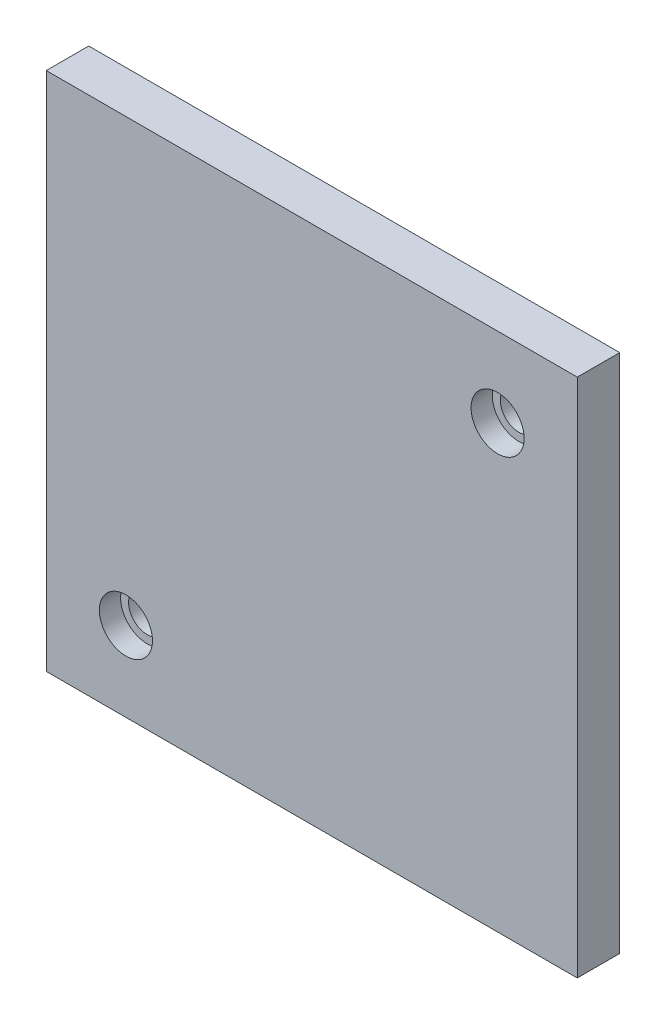
from build123d import *

# Parameters (mm, degrees)
SKETCH_1_W          = 50
SKETCH_1_H          = 49
EXTRUDE_1_DEPTH     = 4
SKETCH_2_R          = 2.5
CUT_EXTRUDE_1_DEPTH = 2
SKETCH_3_R          = 1.75
CUT_EXTRUDE_2_DEPTH = 4


with BuildPart() as part:
    # 草图1 → 凸台-拉伸1 (new body)
    with BuildSketch(Plane.XY):
        Rectangle(SKETCH_1_W, SKETCH_1_H)
    extrude(amount=EXTRUDE_1_DEPTH)

    # 草图2 → 切除-拉伸1 (cut)
    with BuildSketch(Plane.XY.offset(4)):
        with Locations((17.5, 17)):
            Circle(SKETCH_2_R)
        with Locations((-17.5, -17)):
            Circle(SKETCH_2_R)
    extrude(amount=-CUT_EXTRUDE_1_DEPTH, mode=Mode.SUBTRACT)

    # 草图3 → 切除-拉伸2 (cut)
    with BuildSketch(Plane.XY.offset(2)):
        with Locations((-17.5, -17)):
            Circle(SKETCH_3_R)
        with Locations((17.5, 17)):
            Circle(SKETCH_3_R)
    extrude(amount=-CUT_EXTRUDE_2_DEPTH, mode=Mode.SUBTRACT)


solid = part.part
